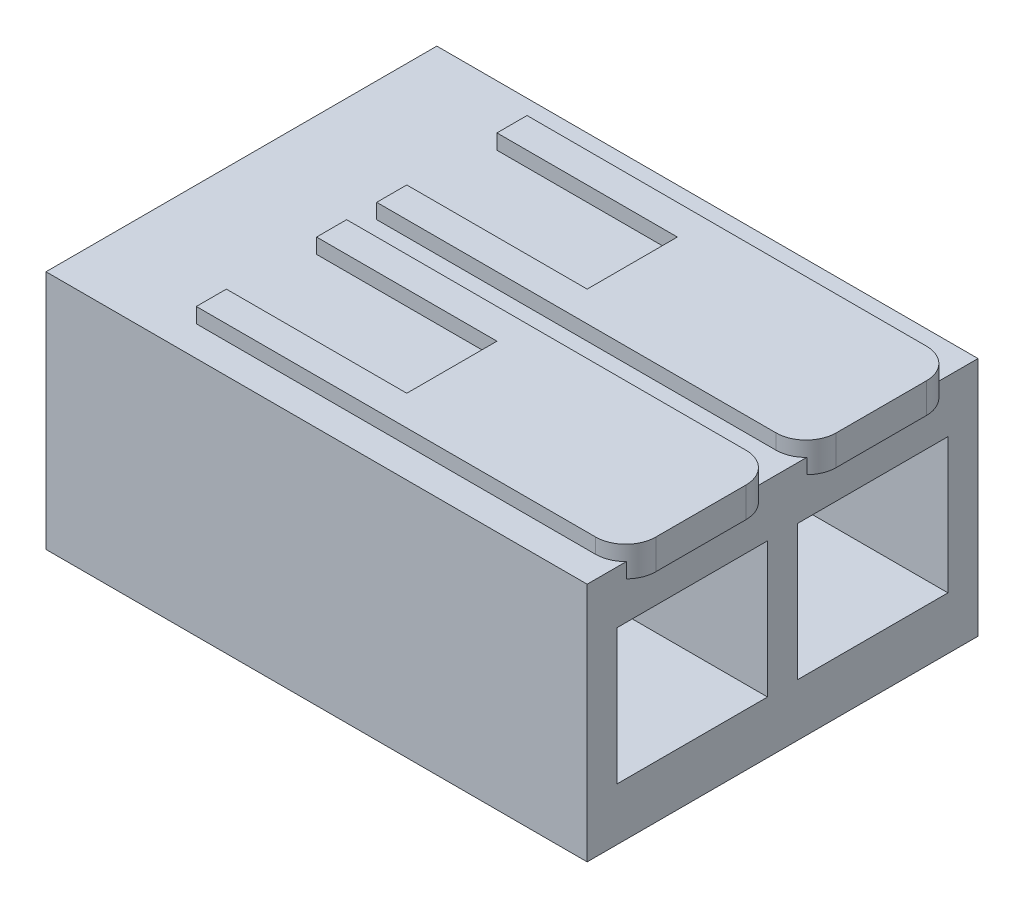
from build123d import *

# Parameters (mm, degrees)
BOSS_EXTRU_1_DEPTH      = 13
ESQUISSE4_W             = 5
ESQUISSE4_H             = 4.5
ENL_V_MAT_EXTRU_2_DEPTH = 5
BOSS_EXTRU_2_DEPTH      = 0.5
BOSS_EXTRU_2_2_DEPTH    = 0.5


with BuildPart() as part:
    # Esquisse1 → Boss.-Extru.1 (new body)
    with BuildSketch(Plane.XY):
        Polygon((0, 0), (18, 0), (18, 8), (0, 8), (0, 4), align=None)
    extrude(amount=BOSS_EXTRU_1_DEPTH)

    # Esquisse4 → Enlèv. mat.-Extru.2 (cut)
    with BuildSketch(Plane(origin=(18, 0, 0), x_dir=(0, 0, -1), z_dir=(1, 0, 0))):
        with Locations((-3.5, 4)):
            Rectangle(ESQUISSE4_W, ESQUISSE4_H)
        with Locations((-9.5, 4)):
            Rectangle(ESQUISSE4_W, ESQUISSE4_H)
    extrude(amount=-ENL_V_MAT_EXTRU_2_DEPTH, mode=Mode.SUBTRACT)


with BuildPart() as body_2:
    # Esquisse5 → Boss.-Extru.2 (new, symmetric)
    with BuildSketch(Plane(origin=(0, 8, 0), x_dir=(1, 0, 0), z_dir=(0, 1, 0))):
        with BuildLine():
            Line((4, -1), (17.283200591, -1))
            ThreePointArc((17.283200591, -1), (17.990307373, -1.292893219), (18.283200591, -2))
            Line((18.283200591, -2), (18.283200591, -5))
            ThreePointArc((18.283200591, -5), (17.990307373, -5.707106781), (17.283200591, -6))
            Line((17.283200591, -6), (4, -6))
            Line((4, -6), (4, -5))
            Line((4, -5), (10, -5))
            Line((10, -5), (10, -2))
            Line((10, -2), (4, -2))
            Line((4, -2), (4, -1))
        make_face()
    extrude(amount=BOSS_EXTRU_2_DEPTH, both=True)


with BuildPart() as body_3:
    # Esquisse5 → Boss.-Extru.2 2 (new, symmetric)
    with BuildSketch(Plane(origin=(0, 8, 0), x_dir=(1, 0, 0), z_dir=(0, 1, 0))):
        with BuildLine():
            Line((4, -7), (17.283200591, -7))
            ThreePointArc((17.283200591, -7), (17.990307373, -7.292893219), (18.283200591, -8))
            Line((18.283200591, -8), (18.283200591, -11))
            ThreePointArc((18.283200591, -11), (17.990307373, -11.707106781), (17.283200591, -12))
            Line((17.283200591, -12), (4, -12))
            Line((4, -12), (4, -11))
            Line((4, -11), (10, -11))
            Line((10, -11), (10, -8))
            Line((10, -8), (4, -8))
            Line((4, -8), (4, -7))
        make_face()
    extrude(amount=BOSS_EXTRU_2_2_DEPTH, both=True)


solid = Compound([part.part, body_2.part, body_3.part])
